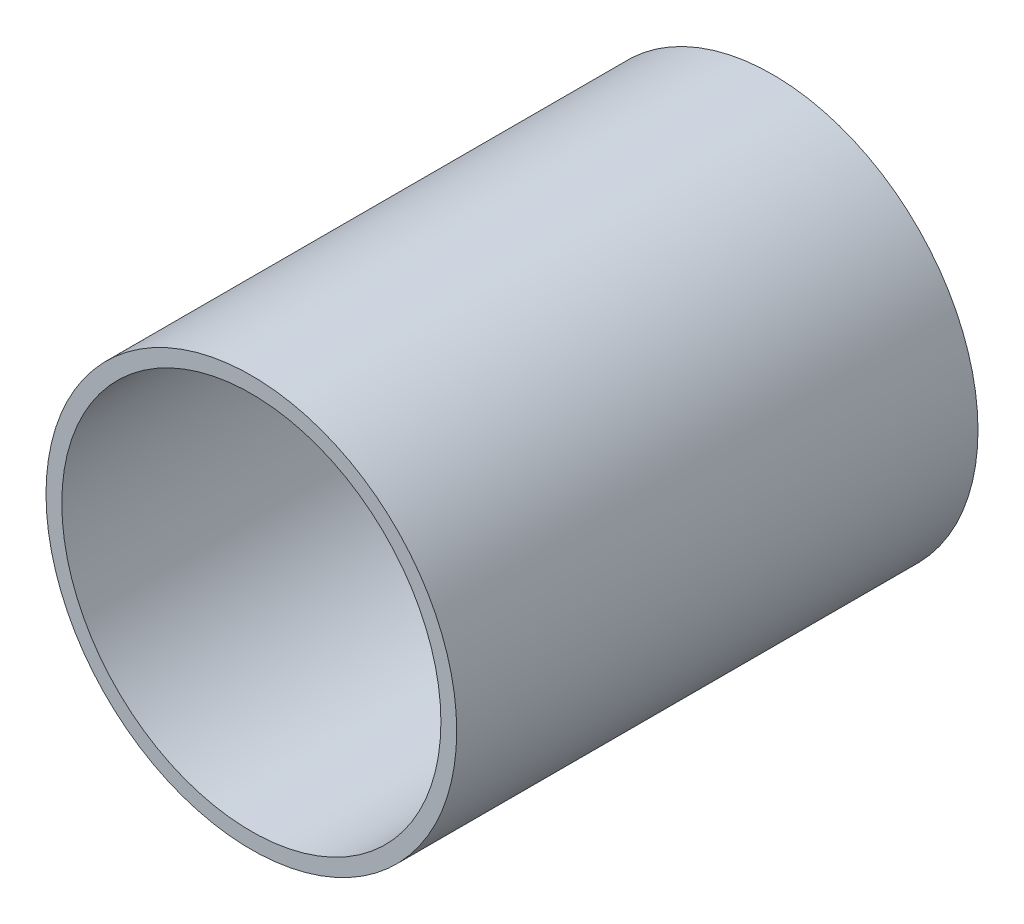
from build123d import *

# Parameters (mm, degrees)
SKETCH2_R           = 82.55
SKETCH2_R_2         = 76.2
BOSS_EXTRUDE1_DEPTH = 209.55


with BuildPart() as part:
    # Sketch2 → Boss-Extrude1 (new body)
    with BuildSketch(Plane(origin=(0, 0, 104.775), x_dir=(-1, 0, 0), z_dir=(0, 0, -1))):
        with Locations(Location((0, 0, 0), (0, 0, 180))):
            Circle(SKETCH2_R)
        with Locations(Location((0, 0, 0), (0, 0, 180))):
            Circle(SKETCH2_R_2, mode=Mode.SUBTRACT)
    extrude(amount=BOSS_EXTRUDE1_DEPTH)


solid = part.part
